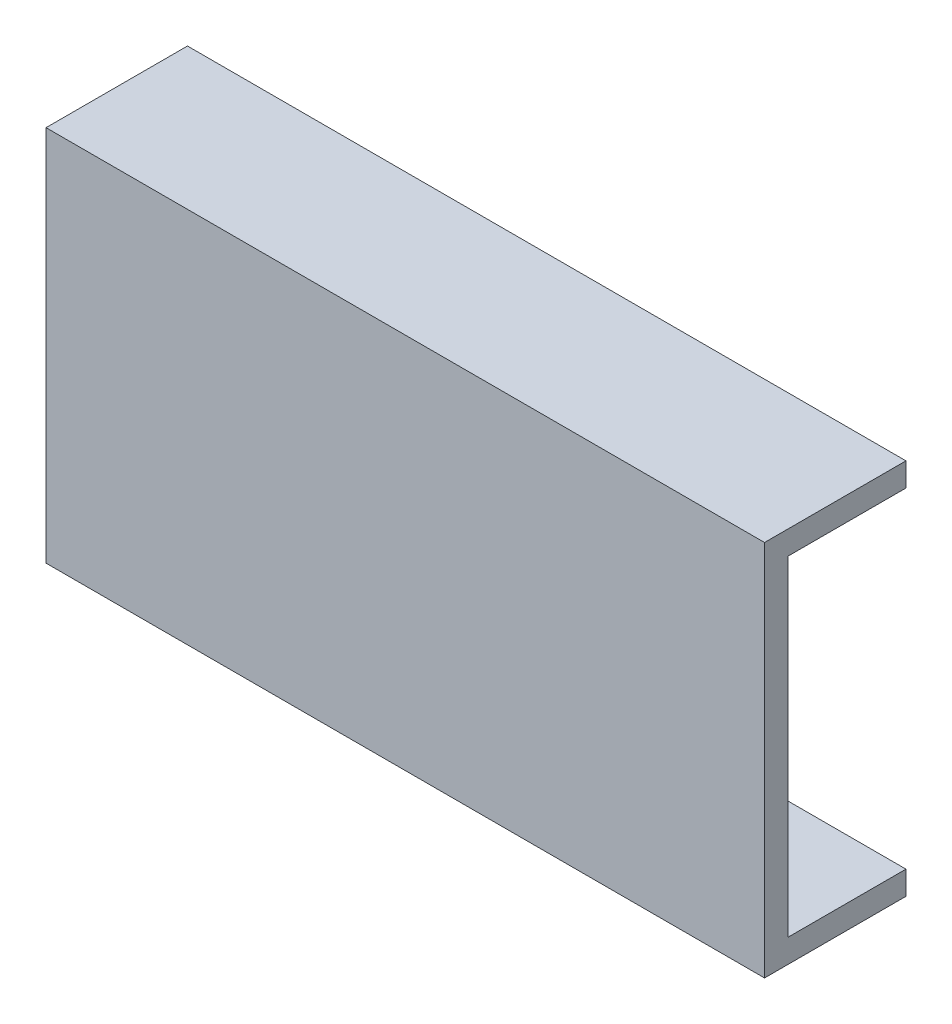
from build123d import *

# Parameters (mm, degrees)
BOSS_EXTRUDE1_DEPTH = 152.4


with BuildPart() as part:
    # Sketch1 → Boss-Extrude1 (new body)
    with BuildSketch(Plane(origin=(0, 0, 0), x_dir=(0, 0, -1), z_dir=(1, 0, 0))):
        Polygon((0, 65.837588936), (30, 65.837588936), (30, 60.837588936), (5, 60.837588936), (5, -9.162411064), (30, -9.162411064), (30, -14.162411064), (0, -14.162411064), align=None)
    extrude(amount=BOSS_EXTRUDE1_DEPTH)


solid = part.part
